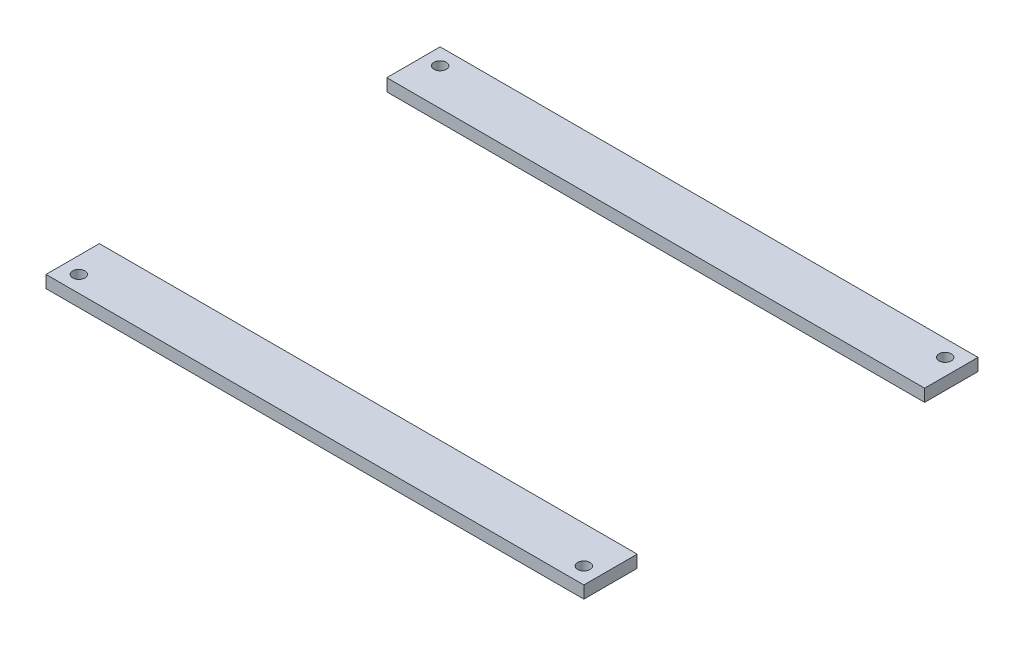
from build123d import *

# Parameters (mm, degrees)
SKETCH1_W             = 131
SKETCH1_H             = 13
SKETCH1_R             = 1.5
BOSS_EXTRUDE1_DEPTH   = 1.5
BOSS_EXTRUDE1_2_DEPTH = 1.5


with BuildPart() as part:
    # Sketch1 → Boss-Extrude1 (new, symmetric)
    with BuildSketch(Plane(origin=(0, 0, 0), x_dir=(1, 0, 0), z_dir=(0, 1, 0))):
        with Locations((0, -41.5)):
            Rectangle(SKETCH1_W, SKETCH1_H)
        with Locations(Location((-61.5, -44, 0), (0, 0, 270))):
            Circle(SKETCH1_R, mode=Mode.SUBTRACT)
        with Locations(Location((61.5, -44, 0), (0, 0, 270))):
            Circle(SKETCH1_R, mode=Mode.SUBTRACT)
    extrude(amount=BOSS_EXTRUDE1_DEPTH, both=True)


with BuildPart() as body_2:
    # Sketch1 → Boss-Extrude1 2 (new, symmetric)
    with BuildSketch(Plane(origin=(0, 0, 0), x_dir=(1, 0, 0), z_dir=(0, 1, 0))):
        with Locations((0, 41.5)):
            Rectangle(SKETCH1_W, SKETCH1_H)
        with Locations(Location((-61.5, 44, 0), (0, 0, 270))):
            Circle(SKETCH1_R, mode=Mode.SUBTRACT)
        with Locations(Location((61.5, 44, 0), (0, 0, 270))):
            Circle(SKETCH1_R, mode=Mode.SUBTRACT)
    extrude(amount=BOSS_EXTRUDE1_2_DEPTH, both=True)


solid = Compound([part.part, body_2.part])
